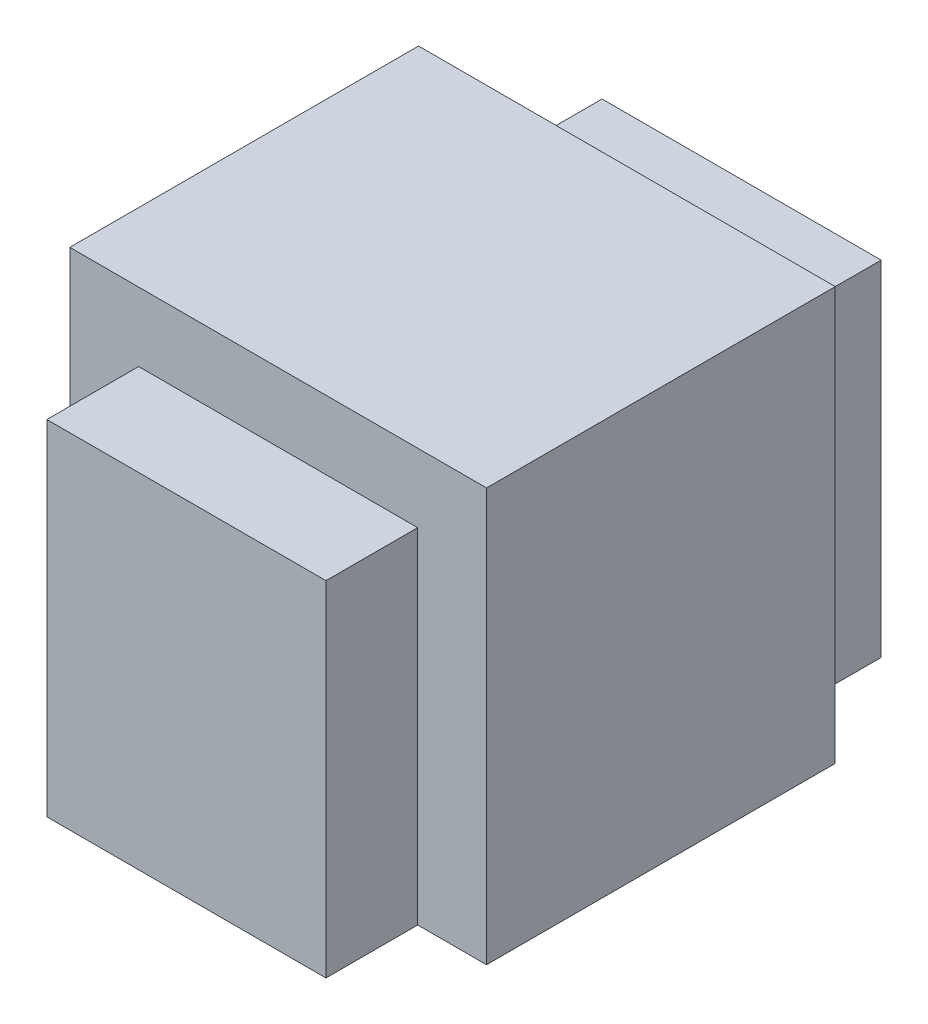
from build123d import *

# Parameters (mm, degrees)
SKETCH1_W           = 90.825
SKETCH1_H           = 90
BOSS_EXTRUDE1_DEPTH = 76
SKETCH2_W           = 60.825
SKETCH2_H           = 75
BOSS_EXTRUDE2_DEPTH = 20
SKETCH3_W           = 60.825
SKETCH3_H           = 75
BOSS_EXTRUDE3_DEPTH = 25


with BuildPart() as part:
    # Sketch1 → Boss-Extrude1 (new body)
    with BuildSketch(Plane.XY):
        with Locations((45.4125, 45)):
            Rectangle(SKETCH1_W, SKETCH1_H)
    extrude(amount=BOSS_EXTRUDE1_DEPTH)

    # Sketch2 → Boss-Extrude2 (add)
    with BuildSketch(Plane.XY.offset(76)):
        with Locations((45.4125, 37.5)):
            Rectangle(SKETCH2_W, SKETCH2_H)
    extrude(amount=BOSS_EXTRUDE2_DEPTH)

    # Sketch3 → Boss-Extrude3 (add)
    with BuildSketch(Plane(origin=(0, 0, 0), x_dir=(-1, 0, 0), z_dir=(0, 0, -1))):
        with Locations((-45.4125, 37.5)):
            Rectangle(SKETCH3_W, SKETCH3_H)
    extrude(amount=BOSS_EXTRUDE3_DEPTH)


solid = part.part
